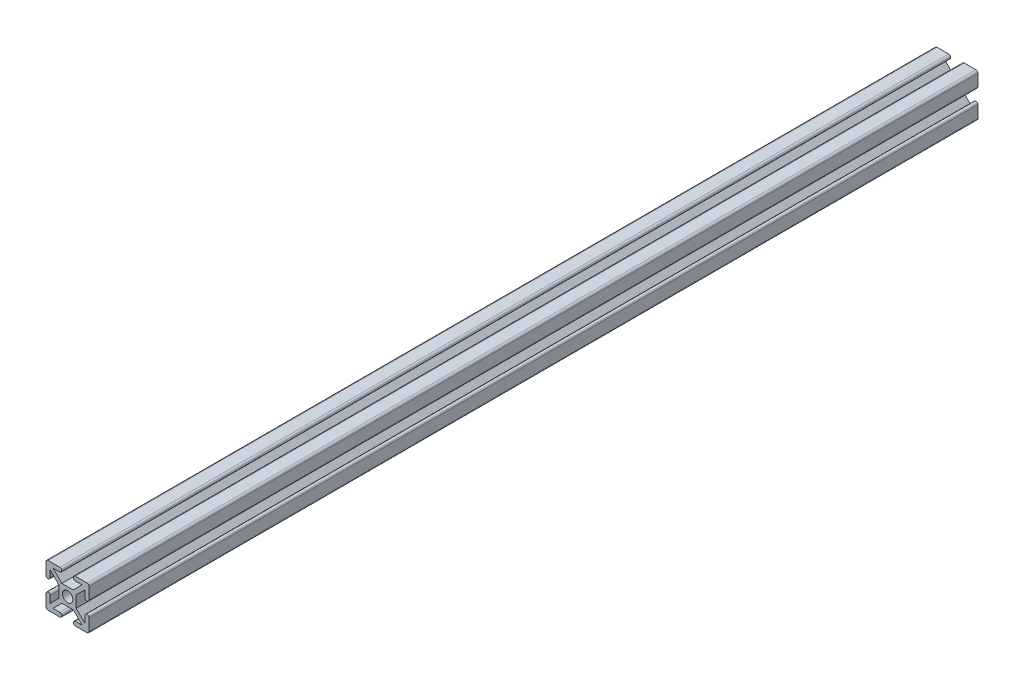
from build123d import *

# Parameters (mm, degrees)
CROQUIS1_R              = 3.645
SALIENTE_EXTRUIR1_DEPTH = 619.12


with BuildPart() as part:
    # Croquis1 → Saliente-Extruir1 (new body)
    with BuildSketch(Plane.XY):
        with BuildLine():
            Line((2.102722117, -1.571983732), (6.827722117, -1.571983732))
            Line((6.827722117, -1.571983732), (0.677722117, 4.578016268))
            Line((0.677722117, 4.578016268), (-7.322277883, 4.578016268))
            Line((-7.322277883, 4.578016268), (-13.472277883, -1.571983732))
            Line((-13.472277883, -1.571983732), (-8.747277883, -1.571983732))
            ThreePointArc((-8.747277883, -1.571983732), (-7.322277883, -2.996983732), (-8.747277883, -4.421983732))
            Line((-8.747277883, -4.421983732), (-16.923713656, -4.395547959))
            ThreePointArc((-16.923713656, -4.395547959), (-17.912647905, -3.985917981), (-18.322277883, -2.996983732))
            Line((-18.322277883, -2.996983732), (-18.322277883, 5.153016268))
            ThreePointArc((-18.322277883, 5.153016268), (-16.923713656, 6.551580495), (-15.525149428, 5.153016268))
            Line((-15.525149428, 5.153016268), (-15.525149428, 0.428016268))
            Line((-15.525149428, 0.428016268), (-9.375149428, 6.578016268))
            Line((-9.375149428, 6.578016268), (-9.375149428, 14.578016268))
            Line((-9.375149428, 14.578016268), (-15.525149428, 20.728016268))
            Line((-15.525149428, 20.728016268), (-15.525149428, 16.003016268))
            ThreePointArc((-15.525149428, 16.003016268), (-16.950149428, 14.578016268), (-18.375149428, 16.003016268))
            Line((-18.375149428, 16.003016268), (-18.375149428, 24.152969678))
            ThreePointArc((-18.375149428, 24.152969678), (-17.957776591, 25.160596841), (-16.950149428, 25.577969678))
            Line((-16.950149428, 25.577969678), (-8.800149428, 25.577969678))
            ThreePointArc((-8.800149428, 25.577969678), (-7.375149428, 24.152969678), (-8.800149428, 22.727969678))
            Line((-8.800149428, 22.727969678), (-13.525149428, 22.727969678))
            Line((-13.525149428, 22.727969678), (-7.375149428, 16.577969678))
            Line((-7.375149428, 16.577969678), (0.624850572, 16.577969678))
            Line((0.624850572, 16.577969678), (6.774850572, 22.727969678))
            Line((6.774850572, 22.727969678), (2.049850572, 22.727969678))
            ThreePointArc((2.049850572, 22.727969678), (0.624850572, 24.152969678), (2.049850572, 25.577969678))
            Line((2.049850572, 25.577969678), (10.199850572, 25.577969678))
            ThreePointArc((10.199850572, 25.577969678), (11.207477735, 25.160596841), (11.624850572, 24.152969678))
            Line((11.624850572, 24.152969678), (11.624850572, 16.106713363))
            ThreePointArc((11.624850572, 16.106713363), (10.199850572, 14.681713363), (8.774850572, 16.106713363))
            Line((8.774850572, 16.106713363), (8.774850572, 20.727969678))
            Line((8.774850572, 20.727969678), (2.624850572, 14.577969678))
            Line((2.624850572, 14.577969678), (2.624850572, 6.577969678))
            Line((2.624850572, 6.577969678), (8.774850572, 0.427969678))
            Line((8.774850572, 0.427969678), (8.774850572, 5.256713363))
            ThreePointArc((8.774850572, 5.256713363), (10.199850572, 6.681713363), (11.624850572, 5.256713363))
            Line((11.624850572, 5.256713363), (11.624850572, -2.996983732))
            ThreePointArc((11.624850572, -2.996983732), (11.207477735, -4.004610895), (10.199850572, -4.421983732))
            Line((10.199850572, -4.421983732), (2.102722117, -4.421983732))
            ThreePointArc((2.102722117, -4.421983732), (0.677722117, -2.996983732), (2.102722117, -1.571983732))
        make_face()
        with Locations((-3.322277883, 10.578016268)):
            Circle(CROQUIS1_R, mode=Mode.SUBTRACT)
    extrude(amount=SALIENTE_EXTRUIR1_DEPTH)


solid = part.part
